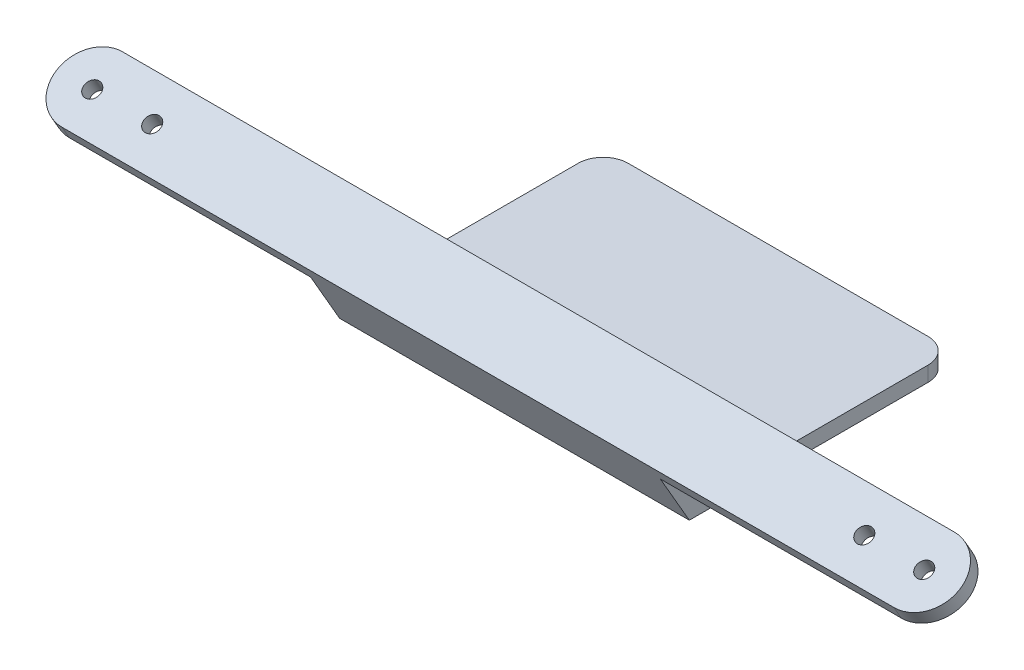
from build123d import *

# Parameters (mm, degrees)
SKETCH_1_W          = 70
SKETCH_1_H          = 50
EXTRUDE_1_DEPTH     = 3
EXTRUDE_2_DEPTH     = 70
SKETCH_3_R          = 1.6
EXTRUDE_3_DEPTH     = 3
EXTRUDE_4_REACH     = 139.875
SKETCH_4_W          = 70
SKETCH_4_H          = 5.267949192
FILLET_1_R          = 5
SKETCH_5_W          = 70
SKETCH_5_H          = 28.866025404
CUT_EXTRUDE_1_DEPTH = 138.47436204
SKETCH_6_W          = 70
SKETCH_6_H          = 3
CUT_EXTRUDE_2_DEPTH = 133.365261865
FILLET_2_R          = 5


with BuildPart() as part:
    # 草图1 → 凸台-拉伸1 (new body)
    with BuildSketch(Plane(origin=(0, 0, 0), x_dir=(1, 0, 0), z_dir=(0, 1, 0))):
        with Locations((35, 25)):
            Rectangle(SKETCH_1_W, SKETCH_1_H)
    extrude(amount=EXTRUDE_1_DEPTH)

    # 草图2 → 凸台-拉伸2 (add)
    with BuildSketch(Plane.ZY):
        Polygon((0, 15), (-6.062177826, 18.5), (-4.562177826, 21.098076211), (4, 16.154700538), (4, 15), (4, 0), (0, 0), align=None)
    extrude(amount=-EXTRUDE_2_DEPTH)

    # 草图3 → 凸台-拉伸3 (add)
    with BuildSketch(Plane(origin=(0, 13.848076211, 7.995190528), x_dir=(1, 0, 0), z_dir=(0, 0.86602540378444, 0.49999999999999784))):
        with BuildLine():
            Line((-48.265, 11.613248654), (-36.265, 11.613248654))
            Line((-36.265, 11.613248654), (106.265, 11.613248654))
            Line((106.265, 11.613248654), (118.265, 11.613248654))
            ThreePointArc((118.265, 11.613248654), (125.265, 4.613248654), (118.265, -2.386751346))
            Line((118.265, -2.386751346), (106.265, -2.386751346))
            Line((106.265, -2.386751346), (-36.265, -2.386751346))
            Line((-36.265, -2.386751346), (-48.265, -2.386751346))
            ThreePointArc((-48.265, -2.386751346), (-55.265, 4.613248654), (-48.265, 11.613248654))
        make_face()
        with Locations(Location((-36.265, 4.613248654, 0), (0, 0, 270))):
            Circle(SKETCH_3_R, mode=Mode.SUBTRACT)
        with Locations(Location((106.265, 4.613248654, 0), (0, 0, 270))):
            Circle(SKETCH_3_R, mode=Mode.SUBTRACT)
        with Locations(Location((-48.265, 4.613248654, 0), (0, 0, 270))):
            Circle(SKETCH_3_R, mode=Mode.SUBTRACT)
        with Locations(Location((118.265, 4.613248654, 0), (0, 0, 270))):
            Circle(SKETCH_3_R, mode=Mode.SUBTRACT)
    extrude(amount=-EXTRUDE_3_DEPTH)

    # 凸台-拉伸4: up to this face of the body (flat: up to its plane)
    extrude_4_end = Plane(part.part.faces().sort_by_distance((35, 6.345299462, 4))[0])
    # 草图4 → 凸台-拉伸4 (add, up to the picked face)
    with BuildSketch(Plane(origin=(0, 11.25, 6.495190528), x_dir=(1, 0, 0), z_dir=(0, -0.8660254037844396, -0.4999999999999982)), mode=Mode.PRIVATE) as extrude_4_sk1:
        with Locations((35, -0.24722325)):
            Rectangle(SKETCH_4_W, SKETCH_4_H)
    extrude_4_tool1 = split(extrude(extrude_4_sk1.sketch, amount=EXTRUDE_4_REACH, mode=Mode.PRIVATE), bisect_by=extrude_4_end, keep=Keep.BOTH, mode=Mode.PRIVATE)
    add(extrude_4_tool1.solids().sort_by(Axis((35, 11.373612, 6.281089), (0, -0.8660254037844396, -0.4999999999999982)))[0])

    # 圆角1
    fillet_1_edges = [part.edges().sort_by_distance(p)[0] for p in [
        (35, 3, 0),
    ]]
    fillet(fillet_1_edges, radius=FILLET_1_R)

    # 草图5 → 切除-拉伸1 (cut, through all)
    with BuildSketch(Plane(origin=(0, -1.193375673, 2.066987298), x_dir=(1, 0, 0), z_dir=(-1.4881366732147052e-15, -0.49999999999999784, 0.8660254037844398))):
        with Locations((35, -10.566987298)):
            Rectangle(SKETCH_5_W, SKETCH_5_H)
    extrude(amount=CUT_EXTRUDE_1_DEPTH, mode=Mode.SUBTRACT)

    # 草图6 → 切除-拉伸2 (cut, through all)
    with BuildSketch(Plane(origin=(0, 5.806624327, -10.057368355), x_dir=(-1, 0, 0), z_dir=(0, 0.49999999999999784, -0.8660254037844398))):
        with Locations((-35, 14.490381057)):
            Rectangle(SKETCH_6_W, SKETCH_6_H)
    extrude(amount=CUT_EXTRUDE_2_DEPTH, mode=Mode.SUBTRACT)

    # 圆角2
    fillet_2_edges = [part.edges().sort_by_distance(p)[0] for p in [
        (0, 1.5, -50),
        (70, 1.5, -50),
    ]]
    fillet(fillet_2_edges, radius=FILLET_2_R)


solid = part.part
